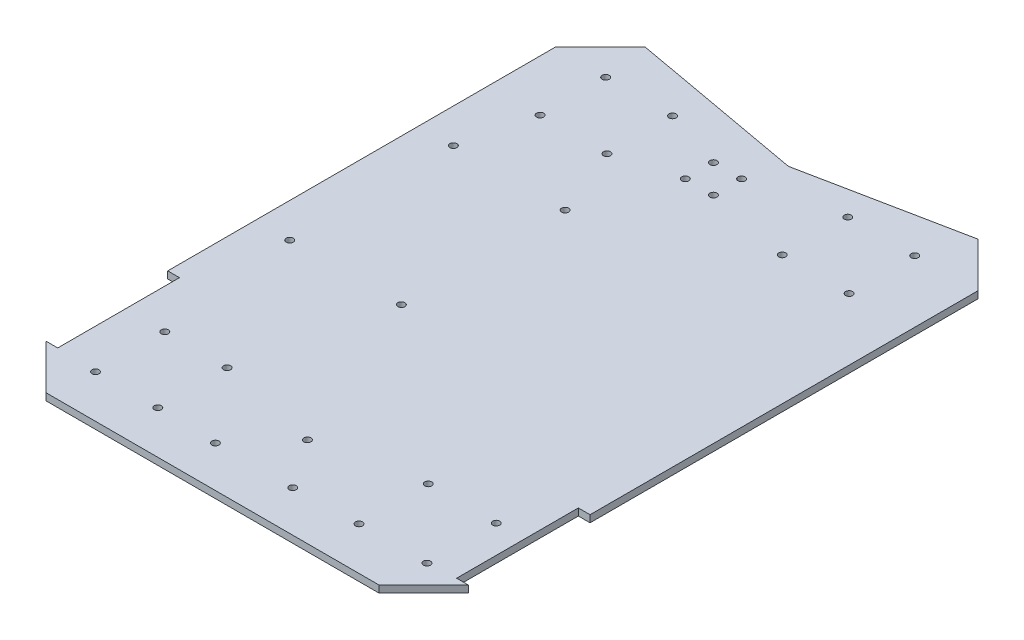
from build123d import *

# Parameters (mm, degrees)
SKETCH_2_W          = 180.073706553
SKETCH_2_H          = 255.410665416
EXTRUDE_1_DEPTH     = 3
CUT_EXTRUDE_1_DEPTH = 3
SKETCH_5_W          = 5
SKETCH_5_H          = 51.907374001
CUT_EXTRUDE_2_DEPTH = 3
MM_TRANSITIONAL_1_D = 3
MM_TRANSITIONAL_2_D = 3
MM_1_D              = 3
MM_2_D              = 3
MM_3_D              = 3


with BuildPart() as part:
    # 草图2 → 凸台-拉伸1 (new body)
    with BuildSketch(Plane(origin=(0, 0, 0), x_dir=(1, 0, 0), z_dir=(0, 1, 0))):
        with Locations((-186.026538889, 60.786498031)):
            Rectangle(SKETCH_2_W, SKETCH_2_H)
    extrude(amount=EXTRUDE_1_DEPTH)

    # 草图4 → 切除-拉伸1 (cut)
    with BuildSketch(Plane(origin=(0, 3, 0), x_dir=(1, 0, 0), z_dir=(0, 1, 0))):
        Polygon((-276.063392165, 188.491830739), (-276.063392165, 169.449737011), (-257.021298437, 188.491830739), align=None)
        Polygon((-182.318869317, 174.967222445), (-115.03177934, 188.491830739), (-257.021298437, 188.491830739), align=None)
        Polygon((-95.989685612, -66.918834677), (-95.989685612, -47.876740949), (-115.03177934, -66.918834677), align=None)
        Polygon((-101.507171046, 174.967222445), (-95.989685612, 169.449737011), (-95.989685612, 188.491830739), (-115.03177934, 188.491830739), align=None)
        Polygon((-276.063392165, -66.918834677), (-257.021298437, -66.918834677), (-276.063392165, -47.876740949), align=None)
    extrude(amount=-CUT_EXTRUDE_1_DEPTH, mode=Mode.SUBTRACT)

    # 草图5 → 切除-拉伸2 (cut)
    with BuildSketch(Plane(origin=(0, 3, 0), x_dir=(1, 0, 0), z_dir=(0, 1, 0))):
        with Locations((-273.563392165, -21.923053949)):
            Rectangle(SKETCH_5_W, SKETCH_5_H)
        with Locations((-98.489685612, -21.923053949)):
            Rectangle(SKETCH_5_W, SKETCH_5_H)
    extrude(amount=-CUT_EXTRUDE_2_DEPTH, mode=Mode.SUBTRACT)

    # 大小mm Transitional 暗销孔1 (through all)
    with Locations(Plane(origin=(0, 3, 0), x_dir=(1, 0, 0), z_dir=(0, 1, 0))):
        with Locations((-254.190617934, 168.879326308), (-254.190617934, 140.929201846), (-225.670082768, 168.879326308), (-225.670082768, 140.929201846), (-150.946280635, 168.879326308), (-150.946280635, 140.929201846)):
            Hole(MM_TRANSITIONAL_1_D / 2)

    # 大小mm Transitional 暗销孔2 (through all)
    with Locations(Plane(origin=(0, 3, 0), x_dir=(1, 0, 0), z_dir=(0, 1, 0))):
        with Locations((-122.425745469, 168.879326308), (-122.425745469, 140.929201846), (-254.190617934, -19.080554812), (-254.190617934, -48.623265957), (-227.646698458, -19.080554812), (-227.646698458, -48.623265957), (-141.859210323, -19.080554812), (-141.859210323, -48.623265957), (-112.884628238, -19.080554812), (-112.884628238, -48.623265957)):
            Hole(MM_TRANSITIONAL_2_D / 2)

    # 大小mm 暗销孔1 (through all)
    with Locations(Plane(origin=(0, 3, 0), x_dir=(1, 0, 0), z_dir=(0, 1, 0))):
        with Locations((-261.411752565, 111.183890873), (-261.411752565, 41.379238152), (-213.780342473, 41.379238152), (-213.780342473, 111.183890873)):
            Hole(MM_1_D / 2)

    # 大小mm 暗销孔2 (through all)
    with Locations(Plane(origin=(0, 0, 0), x_dir=(-1, 0, 0), z_dir=(0, -1, 0))):
        with Locations((202.317574636, -49.390676976), (169.34910988, -49.390676976), (183.870933642, -28.589145642)):
            Hole(MM_2_D / 2)

    # 大小mm 暗销孔3 (through all)
    with Locations(Plane(origin=(0, 0, 0), x_dir=(-1, 0, 0), z_dir=(0, -1, 0))):
        with Locations((199.707102637, 148.354982104), (187.707102637, 148.354982104), (199.707102637, 160.354982104), (187.707102637, 160.354982104)):
            Hole(MM_3_D / 2)


solid = part.part
